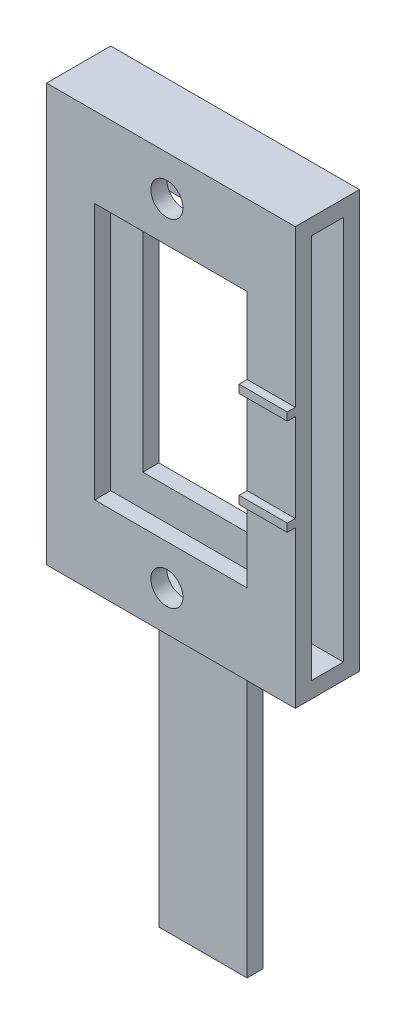
from build123d import *

# Parameters (mm, degrees)
SKETCH1_W                 = 5.5
SKETCH1_H                 = 39.3
BOSS_EXTRUDE1_DEPTH       = 1
SKETCH3_W                 = 15.5
SKETCH3_H                 = 26
BOSS_EXTRUDE5_DEPTH       = 2
SKETCH3_2_W               = 15.5
SKETCH3_2_H               = 26
BOSS_EXTRUDE6_DEPTH       = 2
CUT_EXTRUDE5_DEPTH        = 30.062174729
CUT_EXTRUDE5_DEPTH_BACK   = 14.5
SKETCH10_W                = 2
SKETCH10_H                = 24
SKETCH11_W                = 9.5
SKETCH11_H                = 16
CUT_EXTRUDE7_DEPTH        = 10
F_2_0MM_DOWEL_HOLE1_D     = 2
F_2_0MM_DOWEL_HOLE1_DEPTH = 1
SKETCH15_W                = 3
SKETCH15_H                = 0.5
BOSS_EXTRUDE7_DEPTH       = 0.5


with BuildPart() as part:
    # Sketch1 → Boss-Extrude1 (new body)
    with BuildSketch(Plane.XY):
        Rectangle(SKETCH1_W, SKETCH1_H)
    extrude(amount=BOSS_EXTRUDE1_DEPTH)

    # Sketch3 → Boss-Extrude5 (add, symmetric)
    with BuildSketch(Plane.XY.offset(1)):
        with Locations((0, 11.4)):
            Rectangle(SKETCH3_W, SKETCH3_H)
    extrude(amount=BOSS_EXTRUDE5_DEPTH, both=True)

    # Sketch3<2> → Boss-Extrude6 (add)
    with BuildSketch(Plane.XY.offset(1)):
        with Locations((0, 11.4)):
            Rectangle(SKETCH3_2_W, SKETCH3_2_H)
    extrude(amount=BOSS_EXTRUDE6_DEPTH)

    # Sketch10 → Cut-Extrude5 (cut, two sides: drawn at the far end of the back side and taken through both)
    with BuildSketch(Plane(origin=(7.75, 0, 0), x_dir=(0, 0, -1), z_dir=(1, 0, 0)).offset(-CUT_EXTRUDE5_DEPTH_BACK)):
        with Locations((-1, 11.4)):
            Rectangle(SKETCH10_W, SKETCH10_H)
    extrude(amount=CUT_EXTRUDE5_DEPTH + CUT_EXTRUDE5_DEPTH_BACK, mode=Mode.SUBTRACT)

    # Sketch11 → Cut-Extrude7 (cut)
    with BuildSketch(Plane.XY.offset(3)):
        with Locations((0, 11.4)):
            Rectangle(SKETCH11_W, SKETCH11_H)
    extrude(amount=-CUT_EXTRUDE7_DEPTH, mode=Mode.SUBTRACT)

    # Ø2.0mm Dowel Hole1
    with Locations(Plane(origin=(-0.25, 21.9, 3), x_dir=(1, 0, 0), z_dir=(0, 0, 1))):
        with Locations((0, 0), (0, -21)):
            Hole(F_2_0MM_DOWEL_HOLE1_D / 2, depth=F_2_0MM_DOWEL_HOLE1_DEPTH)

    # Sketch15 → Boss-Extrude7 (add)
    with BuildSketch(Plane.XY.offset(3)):
        with Locations((6.25, 14.4)):
            Rectangle(SKETCH15_W, SKETCH15_H)
        with Locations((6.25, 8.4)):
            Rectangle(SKETCH15_W, SKETCH15_H)
    extrude(amount=BOSS_EXTRUDE7_DEPTH)


solid = part.part
